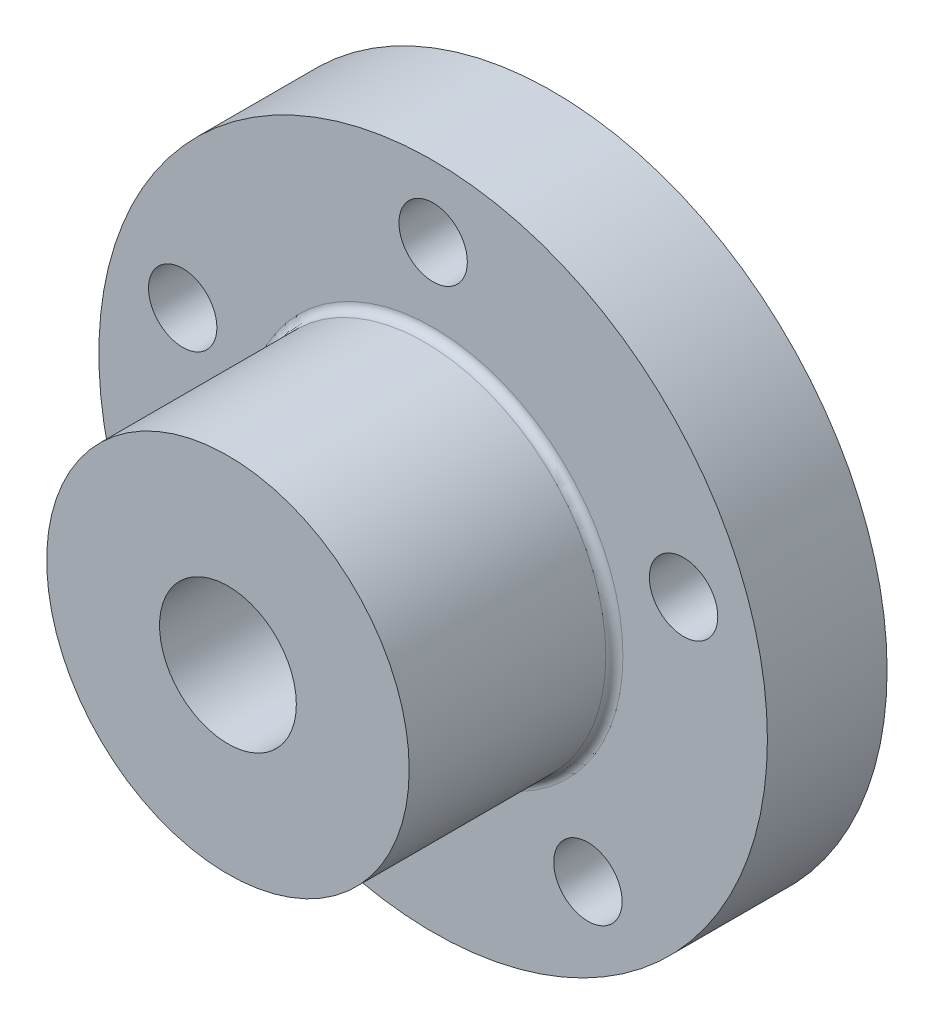
from build123d import *

# Parameters (mm, degrees)
SKETCH_1_R          = 19.55
EXTRUDE_1_DEPTH     = 7
SKETCH_2_R          = 10.6
EXTRUDE_2_DEPTH     = 12
FILLET_1_R          = 0.5
SKETCH_3_R          = 4
CUT_EXTRUDE_3_DEPTH = 34.547056503
SKETCH_4_R          = 2
CUT_EXTRUDE_4_DEPTH = 31.139757796


with BuildPart() as part:
    # Эскиз1 → Вытянуть1 (new body)
    with BuildSketch(Plane.XY):
        Circle(SKETCH_1_R)
    extrude(amount=EXTRUDE_1_DEPTH)

    # Эскиз2 → Вытянуть2 (add)
    with BuildSketch(Plane.XY.offset(7)):
        Circle(SKETCH_2_R)
    extrude(amount=EXTRUDE_2_DEPTH)

    # Скругление1
    fillet_1_edges = [part.edges().sort_by_distance(p)[0] for p in [
        (-10.6, 0, 7),
    ]]
    fillet(fillet_1_edges, radius=FILLET_1_R)

    # Эскиз3 → Вытянуть3 (cut, through all)
    with BuildSketch(Plane.XY.offset(19)):
        Circle(SKETCH_3_R)
    extrude(amount=-CUT_EXTRUDE_3_DEPTH, mode=Mode.SUBTRACT)

    # Эскиз4 → Вытянуть4 (cut, through all)
    with BuildSketch(Plane.XY.offset(7)):
        with Locations((0, 15.4)):
            Circle(SKETCH_4_R)
        with Locations((14.646270351, 4.758861713)):
            Circle(SKETCH_4_R)
        with Locations((9.051892885, -12.458861713)):
            Circle(SKETCH_4_R)
        with Locations((-9.051892885, -12.458861713)):
            Circle(SKETCH_4_R)
        with Locations((-14.646270351, 4.758861713)):
            Circle(SKETCH_4_R)
    extrude(amount=-CUT_EXTRUDE_4_DEPTH, mode=Mode.SUBTRACT)


solid = part.part
